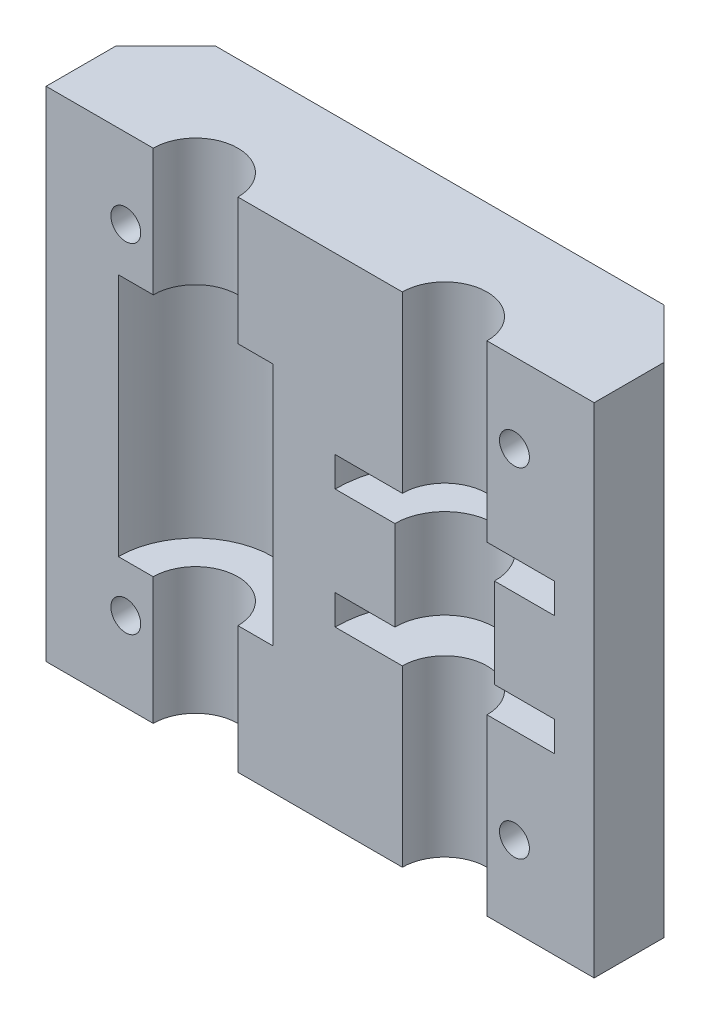
from build123d import *

# Parameters (mm, degrees)
ESQUISSE1_W                  = 55
ESQUISSE1_H                  = 50
BOSS_EXTRU_1_DEPTH           = 12
ESQUISSE2_R                  = 4.25
ENL_V_MAT_EXTRU_1_DEPTH      = 59.311662641
ENL_V_MAT_EXTRU_2_DEPTH      = 12.25
ENL_V_MAT_EXTRU_2_DEPTH_BACK = 12.25
ESQUISSE3_R                  = 7.75
ESQUISSE4_R                  = 11
ENL_V_MAT_EXTRU_3_DEPTH      = 3
ESQUISSE5_R                  = 5
ENL_V_MAT_EXTRU_4_DEPTH      = 15
ENL_V_MAT_EXTRU_5_DEPTH      = 40.05444917
ENL_V_MAT_EXTRU_5_DEPTH_BACK = 40.05444917
ESQUISSE6_R                  = 1.5
ESQUISSE7_R                  = 2.5
ENL_V_MAT_EXTRU_6_DEPTH      = 4
CHANFREIN3_SIZE              = 5


with BuildPart() as part:
    # Esquisse1 → Boss.-Extru.1 (new body)
    with BuildSketch(Plane.XY):
        Rectangle(ESQUISSE1_W, ESQUISSE1_H)
    extrude(amount=BOSS_EXTRU_1_DEPTH)

    # Esquisse2 → Enlèv. mat.-Extru.1 (cut, through all)
    with BuildSketch(Plane(origin=(0, 25, 0), x_dir=(1, 0, 0), z_dir=(0, 1, 0))):
        with Locations((-12.5, -12)):
            Circle(ESQUISSE2_R)
        with Locations((12.5, -12)):
            Circle(ESQUISSE2_R)
    extrude(amount=-ENL_V_MAT_EXTRU_1_DEPTH, mode=Mode.SUBTRACT)

    # Esquisse3 → Enlèv. mat.-Extru.2 (cut, two sides: drawn at the far end of the back side and taken through both)
    with BuildSketch(Plane(origin=(0, 0, 0), x_dir=(1, 0, 0), z_dir=(0, 1, 0)).offset(-ENL_V_MAT_EXTRU_2_DEPTH_BACK)):
        with Locations((-12.5, -12)):
            Circle(ESQUISSE3_R)
    extrude(amount=ENL_V_MAT_EXTRU_2_DEPTH + ENL_V_MAT_EXTRU_2_DEPTH_BACK, mode=Mode.SUBTRACT)

    # Esquisse4 → Enlèv. mat.-Extru.3 (cut)
    with BuildSketch(Plane(origin=(0, 7.5, 0), x_dir=(1, 0, 0), z_dir=(0, 1, 0))):
        with Locations((12.5, -12)):
            Circle(ESQUISSE4_R)
    enl_v_mat_extru_3 = extrude(amount=-ENL_V_MAT_EXTRU_3_DEPTH, mode=Mode.SUBTRACT)

    # Esquisse5 → Enlèv. mat.-Extru.4 (cut)
    with BuildSketch(Plane(origin=(0, 7.5, 0), x_dir=(1, 0, 0), z_dir=(0, 1, 0))):
        with Locations((12.5, -12)):
            Circle(ESQUISSE5_R)
    extrude(amount=-ENL_V_MAT_EXTRU_4_DEPTH, mode=Mode.SUBTRACT)

    # Esquisse6 → Enlèv. mat.-Extru.5 (cut, two sides: drawn at the far end of the back side and taken through both)
    with BuildSketch(Plane(origin=(0, 0, 0), x_dir=(-1, 0, 0), z_dir=(0, 0, -1)).offset(-ENL_V_MAT_EXTRU_5_DEPTH_BACK)):
        with Locations((19.5, -17)):
            Circle(ESQUISSE6_R)
        with Locations((-19.5, -17)):
            Circle(ESQUISSE6_R)
        with Locations((-19.5, 17)):
            Circle(ESQUISSE6_R)
        with Locations((19.5, 17)):
            Circle(ESQUISSE6_R)
    extrude(amount=ENL_V_MAT_EXTRU_5_DEPTH + ENL_V_MAT_EXTRU_5_DEPTH_BACK, mode=Mode.SUBTRACT)

    # Esquisse7 → Enlèv. mat.-Extru.6 (cut)
    with BuildSketch(Plane(origin=(0, 0, 0), x_dir=(-1, 0, 0), z_dir=(0, 0, -1))):
        with Locations((19.5, -17)):
            Circle(ESQUISSE7_R)
        with Locations(Location((19.5, 17, 0), (0, 0, 180))):
            Circle(ESQUISSE7_R)
        with Locations((-19.5, 17)):
            Circle(ESQUISSE7_R)
        with Locations(Location((-19.5, -17, 0), (0, 0, 180))):
            Circle(ESQUISSE7_R)
    extrude(amount=-ENL_V_MAT_EXTRU_6_DEPTH, mode=Mode.SUBTRACT)

    # Chanfrein3
    chanfrein3_edges = [part.edges().sort_by_distance(p)[0] for p in [
        (-27.5, 0, 0),
        (27.5, 0, 0),
    ]]
    chamfer(chanfrein3_edges, length=CHANFREIN3_SIZE)

    # Symétrie2: Enlèv. mat.-Extru.3 across plane
    add(enl_v_mat_extru_3.mirror(Plane.ZX), mode=Mode.SUBTRACT)


solid = part.part
